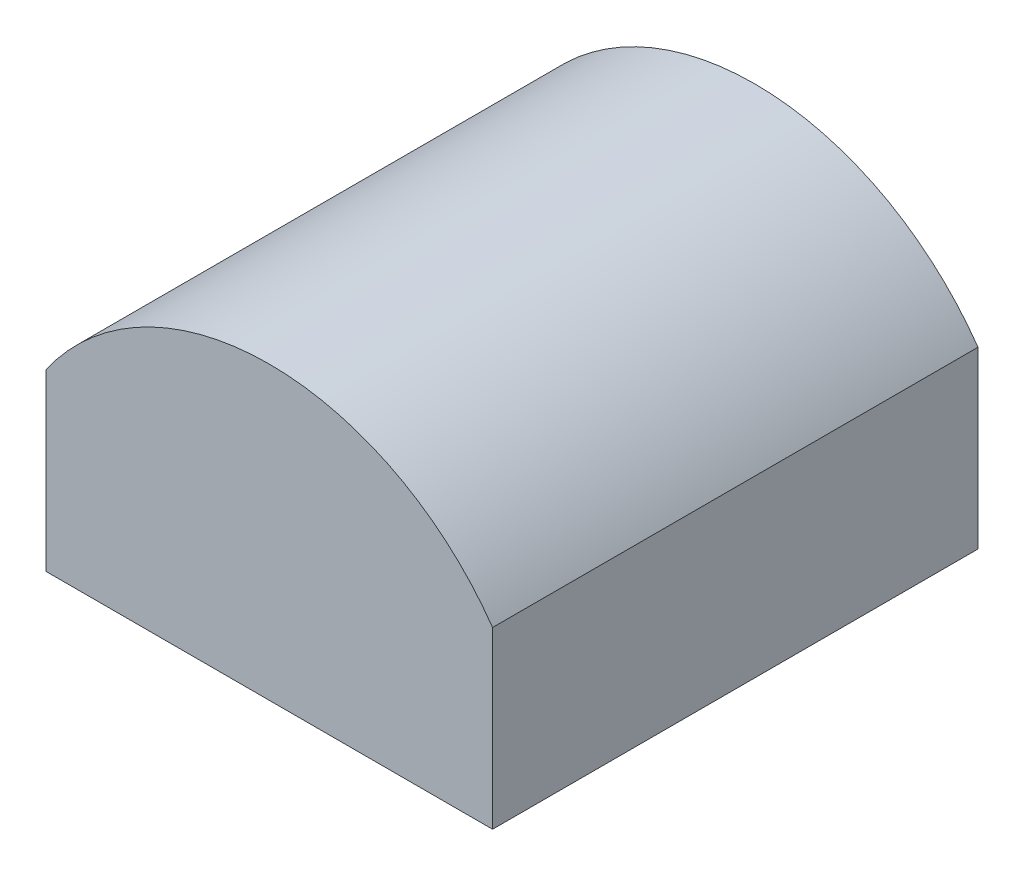
from build123d import *

# Parameters (mm, degrees)
EXTRUDE_1_DEPTH      = 5
EXTRUDE_2_DEPTH      = 5
EXTRUDE_2_DEPTH_BACK = 20


with BuildPart() as part:
    # 草圖1 → 填料-伸長1 (new body)
    with BuildSketch(Plane.XY):
        with BuildLine():
            Line((-8.181868209, 3.138333333), (-8.181868209, -2.861666667))
            Line((-8.181868209, -2.861666667), (8.818131791, -2.861666667))
            Line((8.818131791, -2.861666667), (8.818131791, 3.138333333))
            ThreePointArc((8.818131791, 3.138333333), (0.318131791, 6.138333333), (-8.181868209, 3.138333333))
        make_face()
    extrude(amount=EXTRUDE_1_DEPTH)

    # 草圖1<4> → 填料-伸長2 (add, two sides: drawn at the far end of the back side and taken through both)
    with BuildSketch(Plane.XY.offset(-EXTRUDE_2_DEPTH_BACK)):
        with BuildLine():
            Line((-11.181868209, 3.138333333), (-11.181868209, -5.861666667))
            Line((-11.181868209, -5.861666667), (11.818131791, -5.861666667))
            Line((11.818131791, -5.861666667), (11.818131791, 3.138333333))
            ThreePointArc((11.818131791, 3.138333333), (0.318131791, 9.138333333), (-11.181868209, 3.138333333))
        make_face()
        with BuildLine():
            Line((-8.181868209, 3.138333333), (-8.181868209, -2.861666667))
            Line((-8.181868209, -2.861666667), (8.818131791, -2.861666667))
            Line((8.818131791, -2.861666667), (8.818131791, 3.138333333))
            ThreePointArc((8.818131791, 3.138333333), (0.318131791, 6.138333333), (-8.181868209, 3.138333333))
        make_face(mode=Mode.SUBTRACT)
    extrude(amount=EXTRUDE_2_DEPTH + EXTRUDE_2_DEPTH_BACK)


solid = part.part
